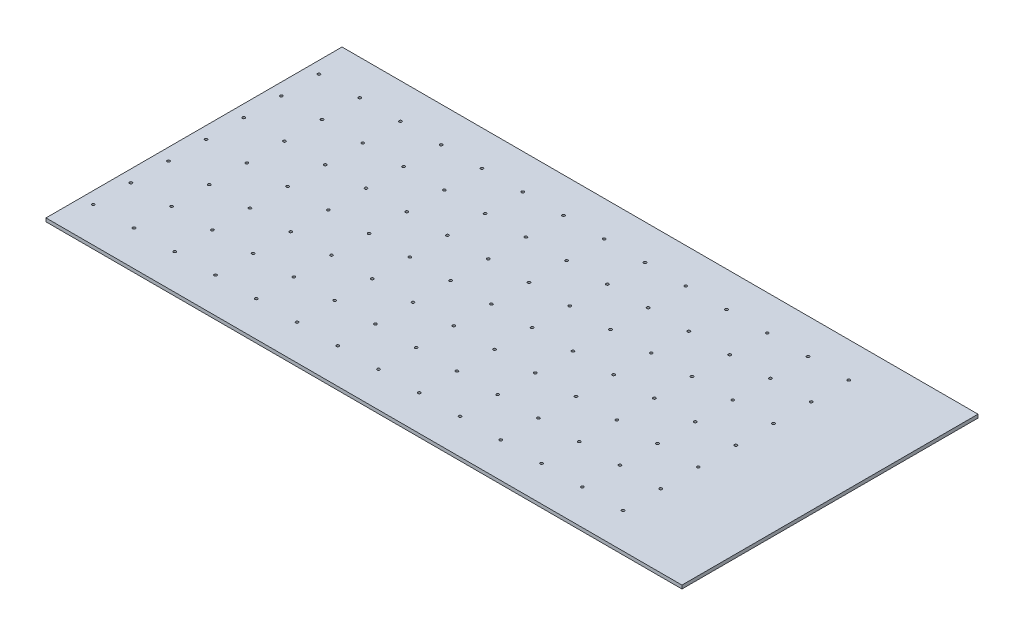
from build123d import *

# Parameters (mm, degrees)
SKETCH1_W            = 540
SKETCH1_H            = 258.64
BOSS_EXTRUDE1_DEPTH  = 3.18
CUT_EXTRUDE1_REACH   = 301.389
SKETCH2_R            = 1.25
LPATTERN1_COUNT      = 14
LPATTERN1_PITCH      = 37.81
LPATTERN1_COUNT_DIR2 = 7
LPATTERN1_PITCH_DIR2 = 34.9
SKETCH3_W            = 258.64
SKETCH3_H            = 3.18
BOSS_EXTRUDE2_DEPTH  = 50
SKETCH4_W            = 590
SKETCH4_H            = 3.18
BOSS_EXTRUDE3_DEPTH  = 8


with BuildPart() as part:
    # Sketch1 → Boss-Extrude1 (new body)
    with BuildSketch(Plane(origin=(0, 0, 0), x_dir=(1, 0, 0), z_dir=(0, 1, 0))):
        Rectangle(SKETCH1_W, SKETCH1_H)
    extrude(amount=BOSS_EXTRUDE1_DEPTH)

    # Sketch2 → Cut-Extrude1 (cut, up to next)
    with BuildSketch(Plane(origin=(0, 3.18, 0), x_dir=(1, 0, 0), z_dir=(0, 1, 0)), mode=Mode.PRIVATE) as cut_extrude1_sk1:
        with Locations(Location((-258.82, 104.72, 0), (0, 0, 270))):
            Circle(SKETCH2_R)
    cut_extrude1_tool1 = extrude(cut_extrude1_sk1.sketch, amount=-CUT_EXTRUDE1_REACH, mode=Mode.PRIVATE) & part.part
    cut_extrude1 = cut_extrude1_tool1.solids().sort_by_distance((-258.82, 3.18, -104.72))[0]
    add(cut_extrude1, mode=Mode.SUBTRACT)

    # LPattern1: Cut-Extrude1 14 × 7
    with Locations(*[(i * LPATTERN1_PITCH, 0, j * LPATTERN1_PITCH_DIR2) for i in range(LPATTERN1_COUNT) for j in range(LPATTERN1_COUNT_DIR2) if (i, j) != (0, 0)]):
        add(cut_extrude1, mode=Mode.SUBTRACT)

    # Sketch3 → Boss-Extrude2 (add)
    with BuildSketch(Plane(origin=(270, 0, 0), x_dir=(0, 0, -1), z_dir=(1, 0, 0))):
        with Locations((0, 1.59)):
            Rectangle(SKETCH3_W, SKETCH3_H)
    extrude(amount=BOSS_EXTRUDE2_DEPTH)

    # Sketch4 → Boss-Extrude3 (add)
    with BuildSketch(Plane.XY.offset(129.32)):
        with Locations((25, 1.59)):
            Rectangle(SKETCH4_W, SKETCH4_H)
    boss_extrude3 = extrude(amount=BOSS_EXTRUDE3_DEPTH)

    # Mirror1: Boss-Extrude3 across plane
    add(boss_extrude3.mirror(Plane.XY))


solid = part.part
